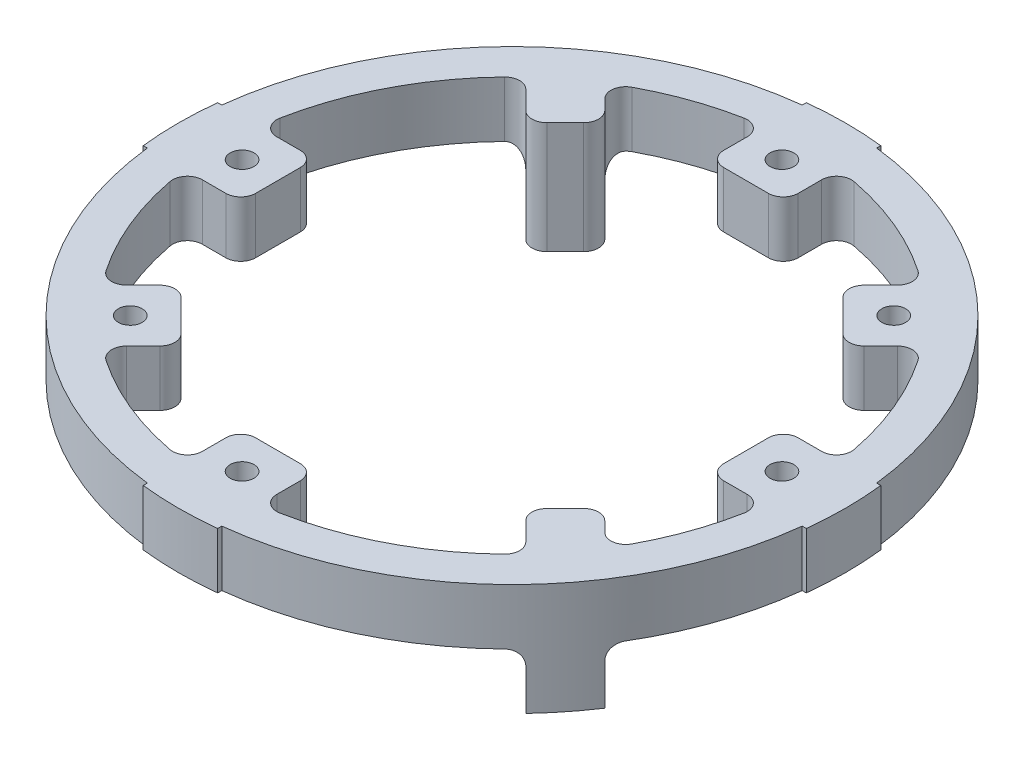
from build123d import *

# Parameters (mm, degrees)
SKETCH1_R           = 1.599999999999998
SKETCH1_R_2         = 1.5999999999996972
SKETCH1_R_3         = 1.6000000000003676
SKETCH1_R_4         = 1.600000000000762
SKETCH1_R_5         = 1.6000000000001544
SKETCH1_R_6         = 1.5999999999994483
BOSS_EXTRUDE1_DEPTH = 7.5
BOSS_EXTRUDE2_START = -15
BOSS_EXTRUDE2_DEPTH = 15
SKETCH3_R           = 1.5999999999999979
CUT_EXTRUDE1_DEPTH  = 15
FILLET3_R           = 2
FILLET4_R           = 2
FILLET5_R           = 2
FILLET6_R           = 2


with BuildPart() as part:
    # Sketch1 → Boss-Extrude1 (new body)
    with BuildSketch(Plane(origin=(0, 0, 0), x_dir=(1, 0, 0), z_dir=(0, 1, 0))):
        with BuildLine():
            Line((-5.000000000000007, 43.96660664640836), (-5.000000000000007, 44.52010781658104))
            ThreePointArc((-5.000000000000007, 44.52010781658104), (-7.2e-15, 44.8), (4.999999999999993, 44.52010781658104))
            Line((4.999999999999993, 44.52010781658104), (4.999999999999993, 43.966606646408366))
            ThreePointArc((4.999999999999993, 43.966606646408366), (31.289475067504778, 31.289475067504675), (43.96660664640838, 4.9999999999998535))
            Line((43.96660664640838, 4.9999999999998535), (44.52010781658105, 4.999999999999852))
            ThreePointArc((44.52010781658105, 4.999999999999852), (44.8, -1.4984e-13), (44.52010781658102, -5.000000000000148))
            Line((44.52010781658102, -5.000000000000148), (43.966606646408344, -5.0000000000001465))
            ThreePointArc((43.966606646408344, -5.0000000000001465), (31.289475067504558, -31.289475067504878), (4.9999999999997, -43.96660664640838))
            Line((4.9999999999997, -43.96660664640838), (4.999999999999696, -44.52010781658105))
            ThreePointArc((4.999999999999696, -44.52010781658105), (-3.0563e-13, -44.79999999999998), (-5.000000000000304, -44.52010781658099))
            Line((-5.000000000000304, -44.52010781658099), (-5.0000000000003, -43.966606646408316))
            ThreePointArc((-5.0000000000003, -43.966606646408316), (-31.289475067505, -31.28947506750445), (-43.96660664640841, -4.999999999999546))
            Line((-43.96660664640841, -4.999999999999546), (-44.52010781658109, -4.999999999999541))
            ThreePointArc((-44.52010781658109, -4.999999999999541), (-44.8, 4.6308e-13), (-44.52010781658098, 5.00000000000046))
            Line((-44.52010781658098, 5.00000000000046), (-43.96660664640831, 5.000000000000454))
            ThreePointArc((-43.96660664640831, 5.000000000000454), (-31.289475067504558, 31.289475067504895), (-5.000000000000007, 43.96660664640836))
        make_face()
        with Locations(Location((36.25, 0, 0), (0, 0, 270))):
            Circle(SKETCH1_R, mode=Mode.SUBTRACT)
        with Locations(Location((8.9734e-13, -36.25, 0), (0, 0, 270))):
            Circle(SKETCH1_R_2, mode=Mode.SUBTRACT)
        with Locations(Location((-25.63262081801145, -25.63262081801235, 0), (0, 0, 270))):
            Circle(SKETCH1_R_3, mode=Mode.SUBTRACT)
        with Locations(Location((-36.249999999999105, -4.44e-15, 0), (0, 0, 270))):
            Circle(SKETCH1_R_4, mode=Mode.SUBTRACT)
        with Locations(Location((8.8846e-13, 36.25, 0), (0, 0, 270))):
            Circle(SKETCH1_R_5, mode=Mode.SUBTRACT)
        with Locations(Location((25.632620818013237, 25.632620818012352, 0), (0, 0, 270))):
            Circle(SKETCH1_R_6, mode=Mode.SUBTRACT)
        with BuildLine():
            Line((33.43022604609433, 5), (36.58637041303769, 5))
            ThreePointArc((36.58637041303769, 5), (38.12774607334069, 5.725574218000316), (38.55073929427462, 7.375838926174497))
            ThreePointArc((38.55073929427462, 7.375838926174497), (36.262271651068, 15.02032472032978), (32.474994896373964, 22.0439834530986))
            ThreePointArc((32.474994896373964, 22.0439834530986), (31.00898015555284, 22.911795444083076), (29.406004523994554, 22.33493671212909))
            Line((29.406004523994554, 22.33493671212909), (27.174273439725177, 20.10320562785971))
            ThreePointArc((27.174273439725177, 20.10320562785971), (25.76005987735207, 19.517419190232797), (24.345846314978967, 20.10320562785971))
            Line((24.345846314978967, 20.10320562785971), (20.1032056278597, 24.345846314978974))
            ThreePointArc((20.1032056278597, 24.345846314978974), (19.51741919023278, 25.76005987735208), (20.103205627859698, 27.174273439725187))
            Line((20.103205627859698, 27.174273439725187), (22.33493671212907, 29.406004523994557))
            ThreePointArc((22.33493671212907, 29.406004523994557), (22.91179544408306, 31.00898015555285), (22.043983453098583, 32.474994896373985))
            ThreePointArc((22.043983453098583, 32.474994896373985), (15.02032472032976, 36.26227165106802), (7.37583892617449, 38.55073929427462))
            ThreePointArc((7.37583892617449, 38.55073929427462), (5.725574218000309, 38.12774607334069), (4.999999999999993, 36.58637041303769))
            Line((4.999999999999993, 36.58637041303769), (4.999999999999994, 33.43022604609433))
            ThreePointArc((4.999999999999994, 33.43022604609433), (4.4142135623730905, 32.01601248372122), (2.9999999999999796, 31.430226046094315))
            Line((2.9999999999999796, 31.430226046094315), (-2.999999999999992, 31.430226046094315))
            ThreePointArc((-2.999999999999992, 31.430226046094315), (-4.414213562373101, 32.01601248372123), (-5.000000000000006, 33.43022604609433))
            Line((-5.000000000000006, 33.43022604609433), (-5.000000000000007, 36.58637041303769))
            ThreePointArc((-5.000000000000007, 36.58637041303769), (-5.7255742180003235, 38.12774607334069), (-7.375838926174504, 38.55073929427462))
            ThreePointArc((-7.375838926174504, 38.55073929427462), (-27.753941161571994, 27.753941161571998), (-38.55073929427462, 7.3758389261744925))
            ThreePointArc((-38.55073929427462, 7.3758389261744925), (-38.12774607334069, 5.725574218000312), (-36.58637041303769, 4.999999999999996))
            Line((-36.58637041303769, 4.999999999999996), (-33.43022604609433, 4.9999999999999964))
            ThreePointArc((-33.43022604609433, 4.9999999999999964), (-32.01601248372122, 4.414213562373094), (-31.430226046094315, 2.9999999999999822))
            Line((-31.430226046094315, 2.9999999999999822), (-31.430226046094315, -2.9999999999999893))
            ThreePointArc((-31.430226046094315, -2.9999999999999893), (-32.01601248372123, -4.4142135623730985), (-33.43022604609433, -5.0000000000000036))
            Line((-33.43022604609433, -5.0000000000000036), (-36.58637041303769, -5.000000000000004))
            ThreePointArc((-36.58637041303769, -5.000000000000004), (-38.12774607334069, -5.725574218000321), (-38.55073929427462, -7.375838926174501))
            ThreePointArc((-38.55073929427462, -7.375838926174501), (-36.26227165106801, -15.02032472032978), (-32.47499489637397, -22.043983453098594))
            ThreePointArc((-32.47499489637397, -22.043983453098594), (-31.008980155552848, -22.911795444083076), (-29.406004523994554, -22.334936712129085))
            Line((-29.406004523994554, -22.334936712129085), (-27.17427343972518, -20.103205627859708))
            ThreePointArc((-27.17427343972518, -20.103205627859708), (-25.760059877352074, -19.517419190232793), (-24.34584631497897, -20.103205627859708))
            Line((-24.34584631497897, -20.103205627859708), (-20.103205627859705, -24.34584631497897))
            ThreePointArc((-20.103205627859705, -24.34584631497897), (-19.517419190232783, -25.760059877352074), (-20.1032056278597, -27.174273439725184))
            Line((-20.1032056278597, -27.174273439725184), (-22.334936712129075, -29.406004523994554))
            ThreePointArc((-22.334936712129075, -29.406004523994554), (-22.911795444083065, -31.008980155552848), (-22.043983453098587, -32.47499489637398))
            ThreePointArc((-22.043983453098587, -32.47499489637398), (-15.020324720329771, -36.262271651068005), (-7.375838926174493, -38.55073929427462))
            ThreePointArc((-7.375838926174493, -38.55073929427462), (-5.725574218000314, -38.12774607334069), (-4.999999999999997, -36.58637041303769))
            Line((-4.999999999999997, -36.58637041303769), (-4.999999999999998, -33.43022604609433))
            ThreePointArc((-4.999999999999998, -33.43022604609433), (-4.414213562373095, -32.01601248372122), (-2.999999999999984, -31.430226046094315))
            Line((-2.999999999999984, -31.430226046094315), (2.9999999999999876, -31.430226046094315))
            ThreePointArc((2.9999999999999876, -31.430226046094315), (4.414213562373097, -32.01601248372123), (5.000000000000002, -33.43022604609433))
            Line((5.000000000000002, -33.43022604609433), (5.000000000000003, -36.58637041303769))
            ThreePointArc((5.000000000000003, -36.58637041303769), (5.725574218000319, -38.12774607334069), (7.3758389261745, -38.55073929427462))
            ThreePointArc((7.3758389261745, -38.55073929427462), (27.753941161571998, -27.753941161571994), (38.55073929427462, -7.375838926174497))
            ThreePointArc((38.55073929427462, -7.375838926174497), (38.12774607334069, -5.725574218000316), (36.58637041303769, -5))
            Line((36.58637041303769, -5), (33.43022604609433, -5))
            ThreePointArc((33.43022604609433, -5), (32.01601248372123, -4.414213562373095), (31.430226046094315, -2.999999999999986))
            Line((31.430226046094315, -2.999999999999986), (31.430226046094315, 2.999999999999986))
            ThreePointArc((31.430226046094315, 2.999999999999986), (32.01601248372123, 4.414213562373095), (33.43022604609433, 5))
        make_face(mode=Mode.SUBTRACT)
    extrude(amount=BOSS_EXTRUDE1_DEPTH)

    # Sketch2 → Boss-Extrude2 (add)
    with BuildSketch(Plane(origin=(0, 7.5, 0), x_dir=(1, 0, 0), z_dir=(0, 1, 0)).offset(BOSS_EXTRUDE2_START)):
        with BuildLine():
            Line((-30.348716864560213, 32.202762065927786), (-22.924095662101468, 24.778140863469048))
            ThreePointArc((-22.924095662101468, 24.778140863469048), (-21.509882099728365, 24.192354425842133), (-20.095668537355262, 24.778140863469048))
            Line((-20.095668537355262, 24.778140863469048), (-17.620794803202365, 27.253014597621945))
            ThreePointArc((-17.620794803202365, 27.253014597621945), (-17.03500836557545, 28.66722815999505), (-17.620794803202365, 30.081441722368155))
            Line((-17.620794803202365, 30.081441722368155), (-24.43259094183973, 36.89323786100552))
            ThreePointArc((-24.43259094183973, 36.89323786100552), (-27.490872340486693, 34.674406093818874), (-30.348716864560213, 32.202762065927786))
        make_face()
        with BuildLine():
            Line((24.778140863469044, -20.09566853735524), (27.253014597621938, -17.620794803202347))
            ThreePointArc((27.253014597621938, -17.620794803202347), (28.66722815999504, -17.035008365575433), (30.081441722368144, -17.620794803202347))
            Line((30.081441722368144, -17.620794803202347), (36.89323786100551, -24.4325909418397))
            ThreePointArc((36.89323786100551, -24.4325909418397), (34.67440609381886, -27.49087234048667), (32.20276206592778, -30.348716864560195))
            Line((32.20276206592778, -30.348716864560195), (24.778140863469044, -22.924095662101447))
            ThreePointArc((24.778140863469044, -22.924095662101447), (24.19235442584213, -21.509882099728344), (24.778140863469044, -20.09566853735524))
        make_face()
    extrude(amount=BOSS_EXTRUDE2_DEPTH)

    # Sketch3 → Cut-Extrude1 (cut)
    with BuildSketch(Plane(origin=(0.9270226006838173, 0, -0.9270226006838158), x_dir=(0.7071067811865471, 0, 0.7071067811865479), z_dir=(-0.7071067811865479, 0, 0.7071067811865471))):
        with Locations((-38, -4.5)):
            Circle(SKETCH3_R)
        with Locations(Location((38, -4.49999999999999, 0), (0, 0, 180))):
            Circle(SKETCH3_R)
    extrude(amount=-CUT_EXTRUDE1_DEPTH, mode=Mode.SUBTRACT)

    # Fillet3
    fillet3_edges = [part.edges().sort_by_distance(p)[0] for p in [
        (28.665477480107445, 3.75, 26.811432278739854),
        (30.434119773017613, 0, 28.58007457165003),
    ]]
    fillet(fillet3_edges, radius=FILLET3_R)

    # Fillet4
    fillet4_edges = [part.edges().sort_by_distance(p)[0] for p in [
        (33.27592050584852, 3.75, 20.815273586682707),
        (35.08457918342702, 8.9e-16, 22.623932264261207),
    ]]
    fillet(fillet4_edges, radius=FILLET4_R)

    # Fillet5
    fillet5_edges = [part.edges().sort_by_distance(p)[0] for p in [
        (-20.815273586682718, 3.75, -33.275920505848504),
        (-22.62393226426122, 0, -35.08457918342701),
    ]]
    fillet(fillet5_edges, radius=FILLET5_R)

    # Fillet6
    fillet6_edges = [part.edges().sort_by_distance(p)[0] for p in [
        (-26.811432278739865, 3.75, -28.66547748010744),
        (-28.580074571650037, 8.9e-16, -30.434119773017613),
    ]]
    fillet(fillet6_edges, radius=FILLET6_R)


solid = part.part
